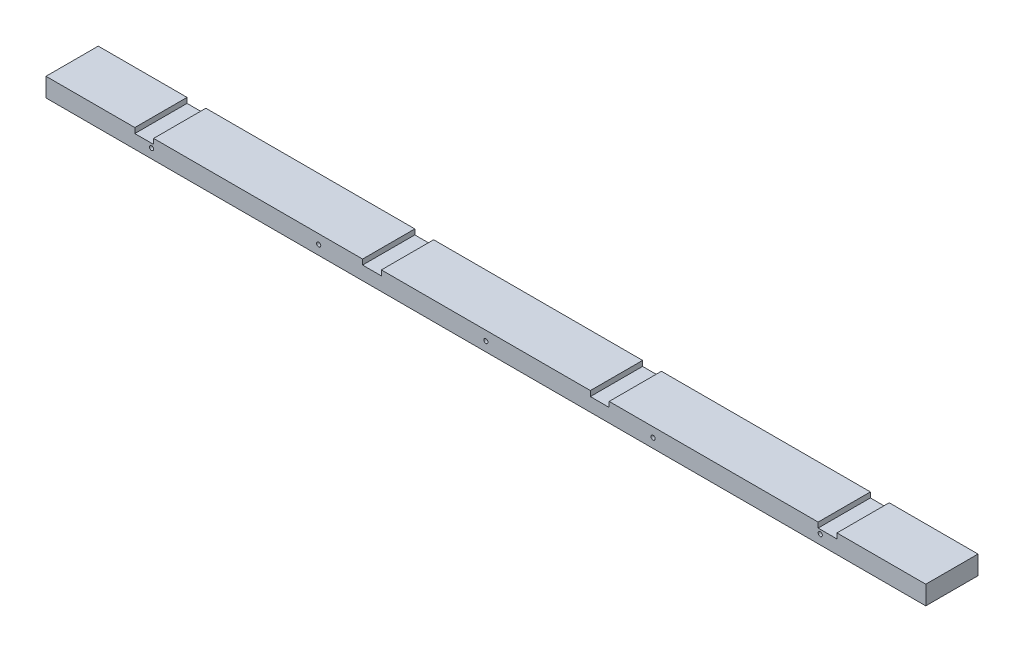
from build123d import *

# Parameters (mm, degrees)
SKETCH1_W                    = 842
SKETCH1_H                    = 50
BOSS_EXTRUDE1_DEPTH          = 18
SKETCH2_W                    = 18
SKETCH2_H                    = 234.314907891
CUT_EXTRUDE1_DEPTH           = 5
F_4_0_4_DIAMETER_HOLE1_D     = 4
F_4_0_4_DIAMETER_HOLE1_DEPTH = 30
F_4_0_4_DIAMETER_HOLE1_TIP   = 1.201721238
F_4_0_4_DIAMETER_HOLE2_D     = 4
F_4_0_4_DIAMETER_HOLE2_DEPTH = 30
F_4_0_4_DIAMETER_HOLE2_TIP   = 1.201721238


with BuildPart() as part:
    # Sketch1 → Boss-Extrude1 (new body)
    with BuildSketch(Plane(origin=(0, 0, 0), x_dir=(1, 0, 0), z_dir=(0, 1, 0))):
        Rectangle(SKETCH1_W, SKETCH1_H)
    extrude(amount=BOSS_EXTRUDE1_DEPTH)

    # Sketch2 → Cut-Extrude1 (cut)
    with BuildSketch(Plane(origin=(0, 18, 0), x_dir=(1, 0, 0), z_dir=(0, 1, 0))):
        with Locations((-327, 12.382649644)):
            Rectangle(SKETCH2_W, SKETCH2_H)
        with Locations((-109, 12.382649644)):
            Rectangle(SKETCH2_W, SKETCH2_H)
        with Locations((109, 12.382649644)):
            Rectangle(SKETCH2_W, SKETCH2_H)
        with Locations((327, 12.382649644)):
            Rectangle(SKETCH2_W, SKETCH2_H)
    extrude(amount=-CUT_EXTRUDE1_DEPTH, mode=Mode.SUBTRACT)

    # Ø4.0 (4) Diameter Hole1
    with Locations(Plane.XY.offset(25)):
        with Locations((-320, 9), (-160, 9), (0, 9), (160, 9), (320, 9)):
            Hole(F_4_0_4_DIAMETER_HOLE1_D / 2, depth=F_4_0_4_DIAMETER_HOLE1_DEPTH)
            with Locations((0, 0, -(F_4_0_4_DIAMETER_HOLE1_DEPTH + F_4_0_4_DIAMETER_HOLE1_TIP / 2))):  # 118° drill point
                Cone(0, F_4_0_4_DIAMETER_HOLE1_D / 2, F_4_0_4_DIAMETER_HOLE1_TIP, mode=Mode.SUBTRACT)

    # Ø4.0 (4) Diameter Hole2
    with Locations(Plane(origin=(0, 0, -25), x_dir=(-1, 0, 0), z_dir=(0, 0, -1))):
        with Locations((-362.5, 9), (-217.5, 9), (-72.5, 9), (72.5, 9), (217.5, 9), (362.5, 9)):
            Hole(F_4_0_4_DIAMETER_HOLE2_D / 2, depth=F_4_0_4_DIAMETER_HOLE2_DEPTH)
            with Locations((0, 0, -(F_4_0_4_DIAMETER_HOLE2_DEPTH + F_4_0_4_DIAMETER_HOLE2_TIP / 2))):  # 118° drill point
                Cone(0, F_4_0_4_DIAMETER_HOLE2_D / 2, F_4_0_4_DIAMETER_HOLE2_TIP, mode=Mode.SUBTRACT)


solid = part.part
